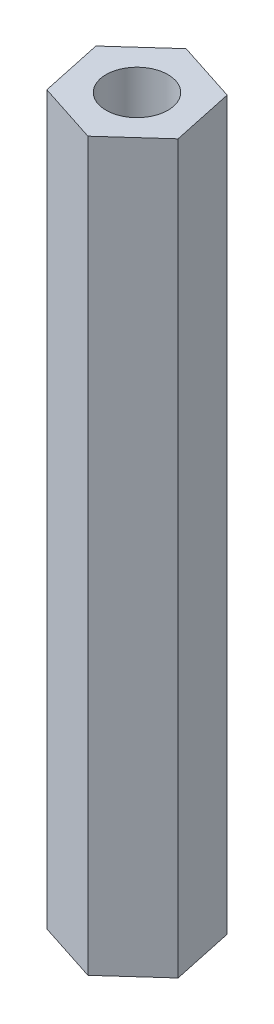
from build123d import *

# Parameters (mm, degrees)
RESSALTO_EXTRUS_O1_DEPTH                    = 37
FURO_ROSCADO_PARA_CONDU_TE_DE_M3X0_51_D     = 3.15
FURO_ROSCADO_PARA_CONDU_TE_DE_M3X0_51_DEPTH = 10
FURO_ROSCADO_PARA_CONDU_TE_DE_M3X0_51_TIP   = 0.946355475
FURO_ROSCADO_PARA_CONDU_TE_DE_M3X0_52_D     = 3.15
FURO_ROSCADO_PARA_CONDU_TE_DE_M3X0_52_DEPTH = 10
FURO_ROSCADO_PARA_CONDU_TE_DE_M3X0_52_TIP   = 0.946355475


with BuildPart() as part:
    # Esboço1 → Ressalto-extrusão1 (new body)
    with BuildSketch(Plane(origin=(0, 0, 0), x_dir=(1, 0, 0), z_dir=(0, 1, 0))):
        Polygon((3.092003015, -1.00100817), (2.412900012, 2.177249074), (-0.679103003, 3.178257244), (-3.092003015, 1.00100817), (-2.412900012, -2.177249074), (0.679103003, -3.178257244), align=None)
    extrude(amount=RESSALTO_EXTRUS_O1_DEPTH)

    # Furo roscado para conduíte de M3x0.51
    with Locations(Plane(origin=(0, 0, 0), x_dir=(-1, 0, 0), z_dir=(0, -1, 0))):
        with Locations((0, 0)):
            Hole(FURO_ROSCADO_PARA_CONDU_TE_DE_M3X0_51_D / 2, depth=FURO_ROSCADO_PARA_CONDU_TE_DE_M3X0_51_DEPTH)
            with Locations((0, 0, -(FURO_ROSCADO_PARA_CONDU_TE_DE_M3X0_51_DEPTH + FURO_ROSCADO_PARA_CONDU_TE_DE_M3X0_51_TIP / 2))):  # 118° drill point
                Cone(0, FURO_ROSCADO_PARA_CONDU_TE_DE_M3X0_51_D / 2, FURO_ROSCADO_PARA_CONDU_TE_DE_M3X0_51_TIP, mode=Mode.SUBTRACT)

    # Furo roscado para conduíte de M3x0.52
    with Locations(Plane(origin=(0, 37, 0), x_dir=(1, 0, 0), z_dir=(0, 1, 0))):
        with Locations((0, 0)):
            Hole(FURO_ROSCADO_PARA_CONDU_TE_DE_M3X0_52_D / 2, depth=FURO_ROSCADO_PARA_CONDU_TE_DE_M3X0_52_DEPTH)
            with Locations((0, 0, -(FURO_ROSCADO_PARA_CONDU_TE_DE_M3X0_52_DEPTH + FURO_ROSCADO_PARA_CONDU_TE_DE_M3X0_52_TIP / 2))):  # 118° drill point
                Cone(0, FURO_ROSCADO_PARA_CONDU_TE_DE_M3X0_52_D / 2, FURO_ROSCADO_PARA_CONDU_TE_DE_M3X0_52_TIP, mode=Mode.SUBTRACT)


solid = part.part
